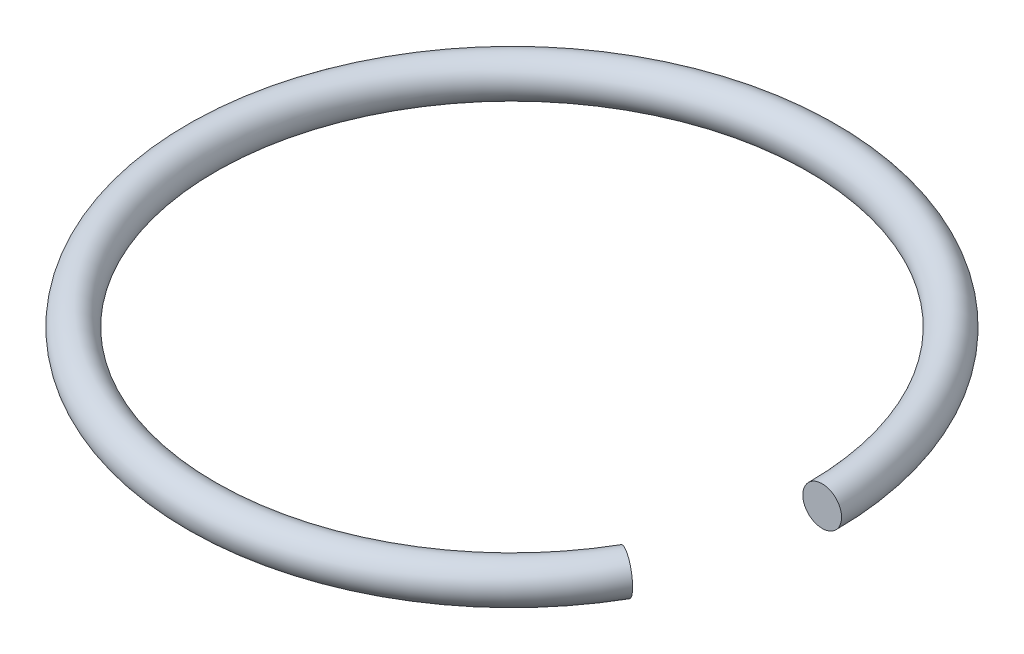
from build123d import *

# Parameters (mm, degrees)
SKETCH1_R      = 0.5
REVOLVE1_ANGLE = 330


with BuildPart() as part:
    # Sketch1 → Revolve1 (revolve)
    with BuildSketch(Plane.XY):
        with Locations((8, 0)):
            Circle(SKETCH1_R)
    revolve(axis=Axis((0, 0, 0), (0, 1, 0)), revolution_arc=REVOLVE1_ANGLE)


solid = part.part
